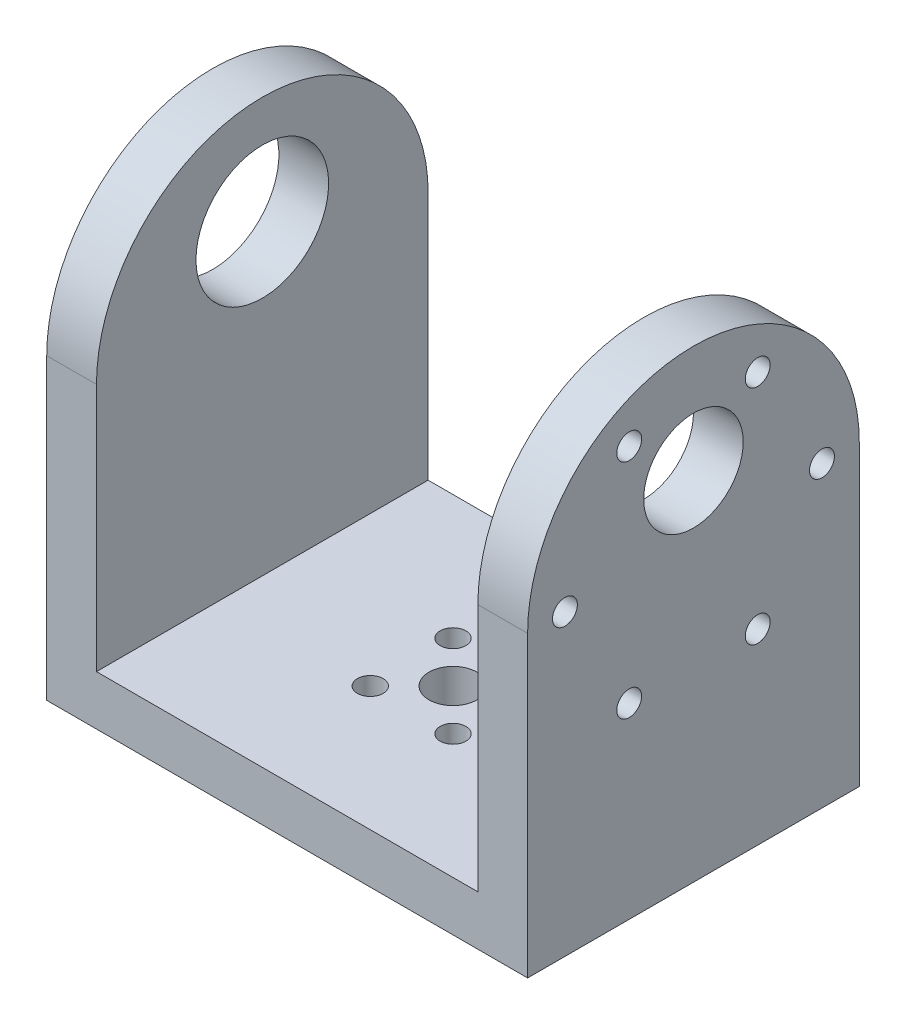
from build123d import *

# Parameters (mm, degrees)
BOSS_EXTRUDE2_DEPTH         = 2
BOSS_EXTRUDE2_DEPTH_BACK    = 4
SKETCH2_W                   = 50
SKETCH2_H                   = 40
BOSS_EXTRUDE3_DEPTH         = 4
BOSS_EXTRUDE3_DEPTH_BACK    = 2
BOSS_EXTRUDE4_DEPTH         = 4
BOSS_EXTRUDE4_DEPTH_BACK    = 2
CUT_EXTRUDE1_DEPTH          = 10
CUT_EXTRUDE1_DEPTH_BACK     = 92
SKETCH7_R                   = 1.5
SKETCH7_R_2                 = 6
SKETCH8_R                   = 2.9
SKETCH8_R_2                 = 1.55
CUT_EXTRUDE2_DEPTH          = 92
SKETCH10_W                  = 4
SKETCH10_H                  = 6
BOSS_EXTRUDE5_DEPTH         = 40
IZIM1_R                     = 2.313202435
KES_EKSTR_ZYON1_DEPTH       = 48
Y_KSEKLIK_EKSTR_ZYON1_DEPTH = 6
IZIM3_R                     = 8
KES_EKSTR_ZYON2_DEPTH       = 6


with BuildPart() as part:
    # Sketch2 → Boss-Extrude2 (new, two sides: drawn at the far end of the back side and taken through both)
    with BuildSketch(Plane(origin=(0, 0, 0), x_dir=(1, 0, 0), z_dir=(0, 1, 0)).offset(-BOSS_EXTRUDE2_DEPTH_BACK)):
        with Locations((3.5, 41.570780176)):
            Rectangle(SKETCH2_W, SKETCH2_H)
    extrude(amount=BOSS_EXTRUDE2_DEPTH + BOSS_EXTRUDE2_DEPTH_BACK)

    # Sketch4 → Boss-Extrude3 (add, two sides: drawn at the far end of the back side and taken through both)
    with BuildSketch(Plane.ZY.offset(21.5).offset(-BOSS_EXTRUDE3_DEPTH_BACK)):
        with BuildLine():
            Line((-21.570780176, 2), (-61.570780176, 2))
            Line((-61.570780176, 2), (-61.570780176, 32))
            ThreePointArc((-61.570780176, 32), (-41.570780176, 52), (-21.570780176, 32))
            Line((-21.570780176, 32), (-21.570780176, 2))
        make_face()
    extrude(amount=BOSS_EXTRUDE3_DEPTH + BOSS_EXTRUDE3_DEPTH_BACK)

    # Sketch5 → Boss-Extrude4 (add, two sides: drawn at the far end of the back side and taken through both)
    with BuildSketch(Plane(origin=(28.5, 0, 0), x_dir=(0, 0, -1), z_dir=(1, 0, 0)).offset(-BOSS_EXTRUDE4_DEPTH_BACK)):
        with BuildLine():
            Line((21.570780176, -4), (61.570780176, -4))
            Line((61.570780176, -4), (61.570780176, 32))
            ThreePointArc((61.570780176, 32), (41.570780176, 52), (21.570780176, 32))
            Line((21.570780176, 32), (21.570780176, -4))
        make_face()
    extrude(amount=BOSS_EXTRUDE4_DEPTH + BOSS_EXTRUDE4_DEPTH_BACK)

    # Sketch7 → Cut-Extrude1 (cut, two sides: drawn at the far end of the back side and taken through both)
    with BuildSketch(Plane.ZY.offset(21.5).offset(-CUT_EXTRUDE1_DEPTH_BACK)):
        with Locations(Location((-26.070780176, 32, 0), (0, 0, 180))):
            Circle(SKETCH7_R)
        with Locations(Location((-33.820780176, 18.576606241, 0), (0, 0, 180))):
            Circle(SKETCH7_R)
        with Locations(Location((-49.320780176, 18.576606241, 0), (0, 0, 180))):
            Circle(SKETCH7_R)
        with Locations(Location((-57.070780176, 32, 0), (0, 0, 180))):
            Circle(SKETCH7_R)
        with Locations(Location((-49.320780176, 45.423393759, 0), (0, 0, 180))):
            Circle(SKETCH7_R)
        with Locations(Location((-33.820780176, 45.423393759, 0), (0, 0, 180))):
            Circle(SKETCH7_R)
        with Locations(Location((-41.570780176, 39, 0), (0, 0, 180))):
            Circle(SKETCH7_R_2)
    extrude(amount=CUT_EXTRUDE1_DEPTH + CUT_EXTRUDE1_DEPTH_BACK, mode=Mode.SUBTRACT)

    # Sketch8 → Cut-Extrude2 (cut)
    with BuildSketch(Plane(origin=(0, 2, 0), x_dir=(1, 0, 0), z_dir=(0, 1, 0))):
        with Locations(Location((3.5, 41.570780176, 0), (0, 0, 270))):
            Circle(SKETCH8_R)
        with Locations(Location((-1.49, 46.560780176, 0), (0, 0, 270))):
            Circle(SKETCH8_R_2)
        with Locations(Location((8.49, 46.560780176, 0), (0, 0, 270))):
            Circle(SKETCH8_R_2)
        with Locations(Location((-1.49, 36.580780176, 0), (0, 0, 270))):
            Circle(SKETCH8_R_2)
        with Locations(Location((8.49, 36.580780176, 0), (0, 0, 270))):
            Circle(SKETCH8_R_2)
    extrude(amount=-CUT_EXTRUDE2_DEPTH, mode=Mode.SUBTRACT)

    # Sketch10 → Boss-Extrude5 (add)
    with BuildSketch(Plane.XY.offset(-21.570780176)):
        with Locations((-23.5, -1)):
            Rectangle(SKETCH10_W, SKETCH10_H)
    extrude(amount=-BOSS_EXTRUDE5_DEPTH)

    # Çizim1 → Kes-Ekstrüzyon1 (cut)
    with BuildSketch(Plane(origin=(-19.5, 0, 0), x_dir=(0, 0, -1), z_dir=(1, 0, 0))):
        with Locations((26.070780176, 32)):
            Circle(IZIM1_R)
        with Locations((33.820780176, 45.423393759)):
            Circle(IZIM1_R)
        with Locations((49.320780176, 45.423393759)):
            Circle(IZIM1_R)
        with Locations((57.070780176, 32)):
            Circle(IZIM1_R)
        with Locations((49.320780176, 18.576606241)):
            Circle(IZIM1_R)
        with Locations((33.820780176, 18.576606241)):
            Circle(IZIM1_R)
    extrude(amount=KES_EKSTR_ZYON1_DEPTH, mode=Mode.SUBTRACT)

    # Çizim2 → Yükseklik-Ekstrüzyon1 (add)
    with BuildSketch(Plane.ZY.offset(25.5)):
        with BuildLine():
            Line((-21.570780176, -4), (-21.570780176, 32))
            ThreePointArc((-21.570780176, 32), (-41.570780176, 52), (-61.570780176, 32))
            Line((-61.570780176, 32), (-61.570780176, -4))
            Line((-61.570780176, -4), (-21.570780176, -4))
        make_face()
    extrude(amount=-Y_KSEKLIK_EKSTR_ZYON1_DEPTH)

    # Çizim3 → Kes-Ekstrüzyon2 (cut)
    with BuildSketch(Plane.ZY.offset(25.5)):
        with Locations((-41.570780176, 39)):
            Circle(IZIM3_R)
    extrude(amount=-KES_EKSTR_ZYON2_DEPTH, mode=Mode.SUBTRACT)


solid = part.part
